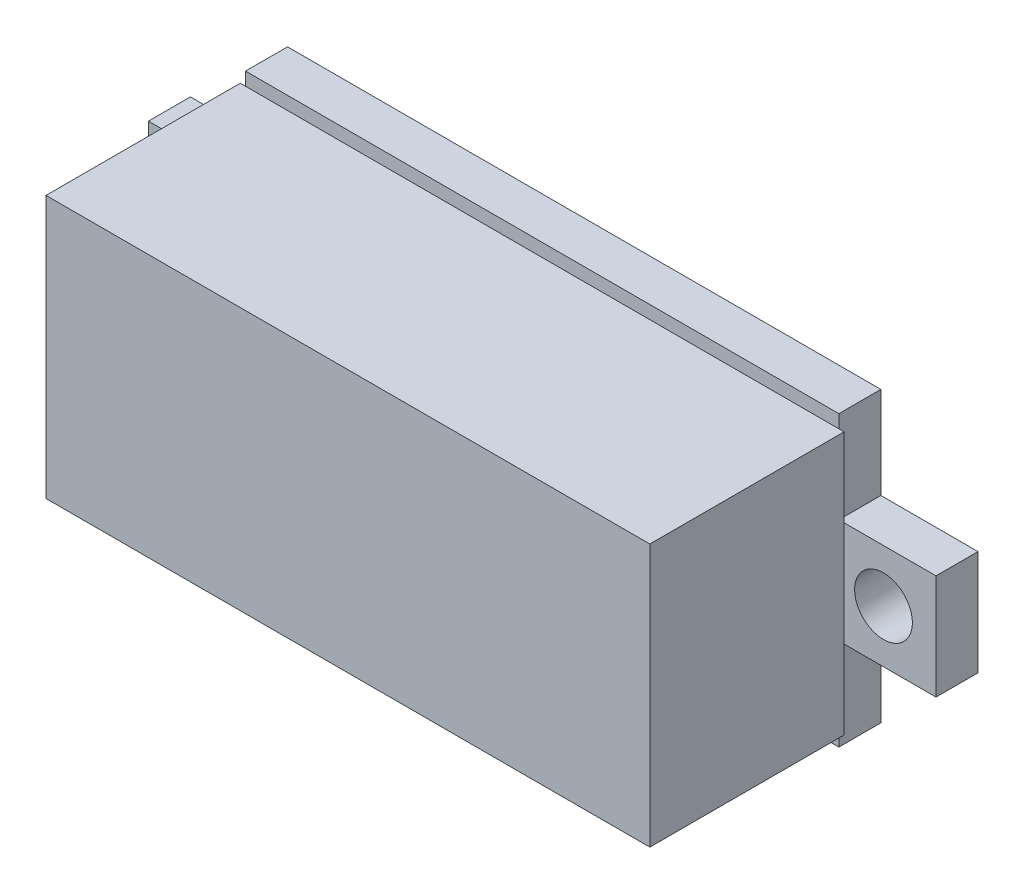
from build123d import *

# Parameters (mm, degrees)
SKETCH_1_W      = 23
SKETCH_1_H      = 10
EXTRUDE_1_DEPTH = 7.4
SKETCH_2_R      = 1.1
EXTRUDE_2_DEPTH = 1.6


with BuildPart() as part:
    # 草图1 → 凸台-拉伸1 (new body)
    with BuildSketch(Plane.XY):
        Rectangle(SKETCH_1_W, SKETCH_1_H)
    extrude(amount=EXTRUDE_1_DEPTH)

    # 草图2 → 凸台-拉伸2 (add)
    with BuildSketch(Plane(origin=(0, 0, 0), x_dir=(-1, 0, 0), z_dir=(0, 0, -1))):
        Polygon((-11.3, -2), (-11.3, -5.5), (11.3, -5.5), (11.3, -2), (15, -2), (15, 2), (11.3, 2), (11.3, 5.5), (-11.3, 5.5), (-11.3, 2), (-15, 2), (-15, -2), align=None)
        with Locations((-13, 0)):
            Circle(SKETCH_2_R, mode=Mode.SUBTRACT)
        with Locations((13, 0)):
            Circle(SKETCH_2_R, mode=Mode.SUBTRACT)
    extrude(amount=EXTRUDE_2_DEPTH)


solid = part.part
